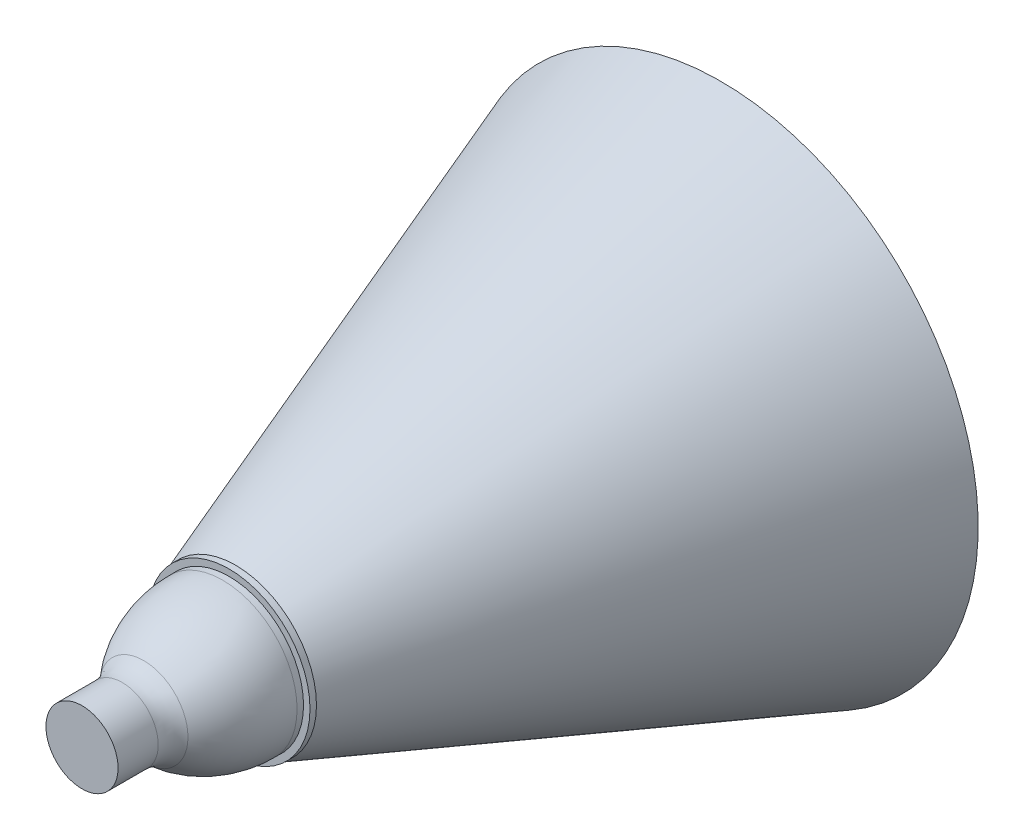
from build123d import *

# Parameters (mm, degrees)
FILLET1_R = 10


with BuildPart() as part:
    # Sketch1 → Revolve1 (revolve)
    with BuildSketch(Plane.YZ, mode=Mode.PRIVATE) as revolve1_sk:
        with BuildLine():
            Line((0, 0), (-25, 0))
            Line((-25, 0), (-25, 2))
            Line((-25, 2), (-23, 2))
            Line((-23, 2), (-23, 4))
            ThreePointArc((-23, 4), (-19.907119135, 18.74298562), (-11.15, 31))
            Line((-11.15, 31), (-11.15, 47.5))
            Line((-11.15, 47.5), (0, 47.5))
            Line((0, 47.5), (0, 0))
        make_face()
    revolve(revolve1_sk.sketch.rotate(Axis((0, 0, 47.5), (0, 0, -1)), 270), axis=Axis((0, 0, 47.5), (0, 0, -1)))

    # Fillet1
    fillet1_edges = [part.edges().sort_by_distance(p)[0] for p in [
        (-11.15, 0, 31),
    ]]
    fillet(fillet1_edges, radius=FILLET1_R)

    # Sketch2 → Revolve2 (revolve)
    with BuildSketch(Plane.YZ, mode=Mode.PRIVATE) as revolve2_sk:
        Polygon((-25, 0), (-79.59553514, -150), (0, -150), (0, 0), align=None)
    revolve(revolve2_sk.sketch.rotate(Axis((0, 0, 0), (0, 0, -1)), 90), axis=Axis((0, 0, 0), (0, 0, -1)))


solid = part.part
